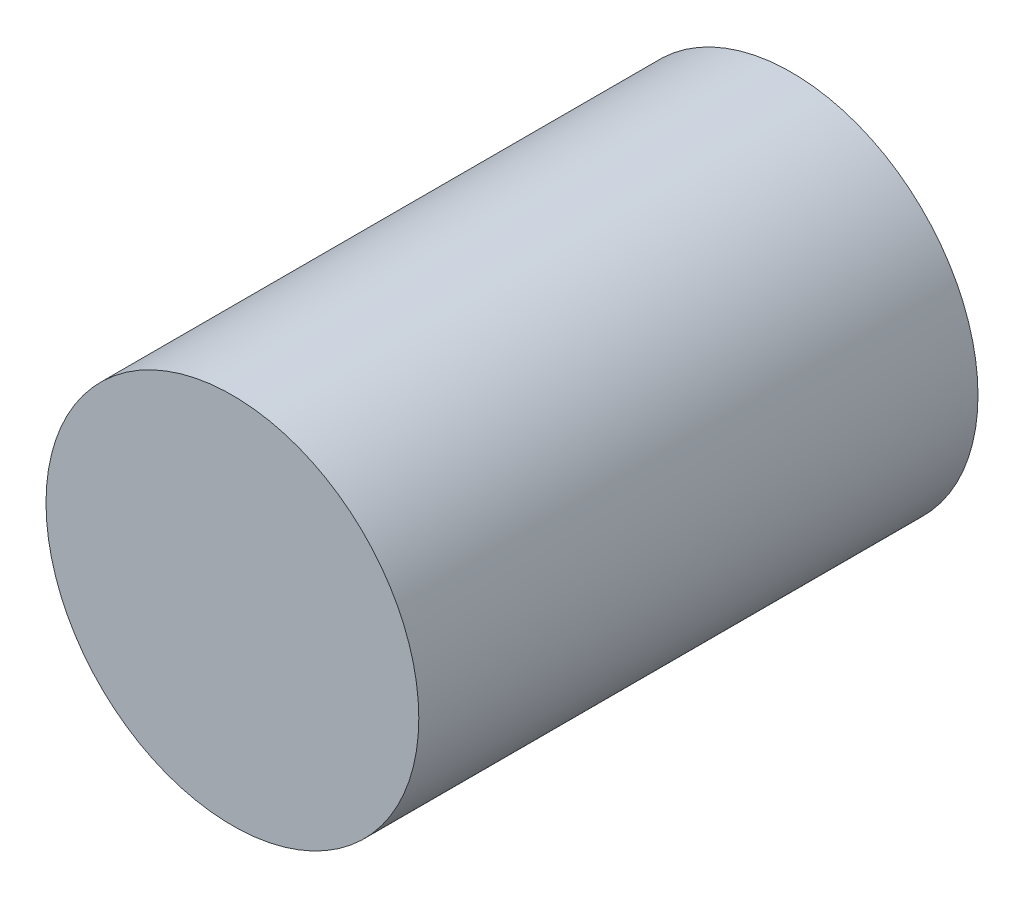
from build123d import *

# Parameters (mm, degrees)
SKETCH1_R           = 100
BOSS_EXTRUDE2_DEPTH = 300


with BuildPart() as part:
    # Sketch1 → Boss-Extrude2 (new body)
    with BuildSketch(Plane.XY):
        Circle(SKETCH1_R)
    extrude(amount=BOSS_EXTRUDE2_DEPTH)


solid = part.part
